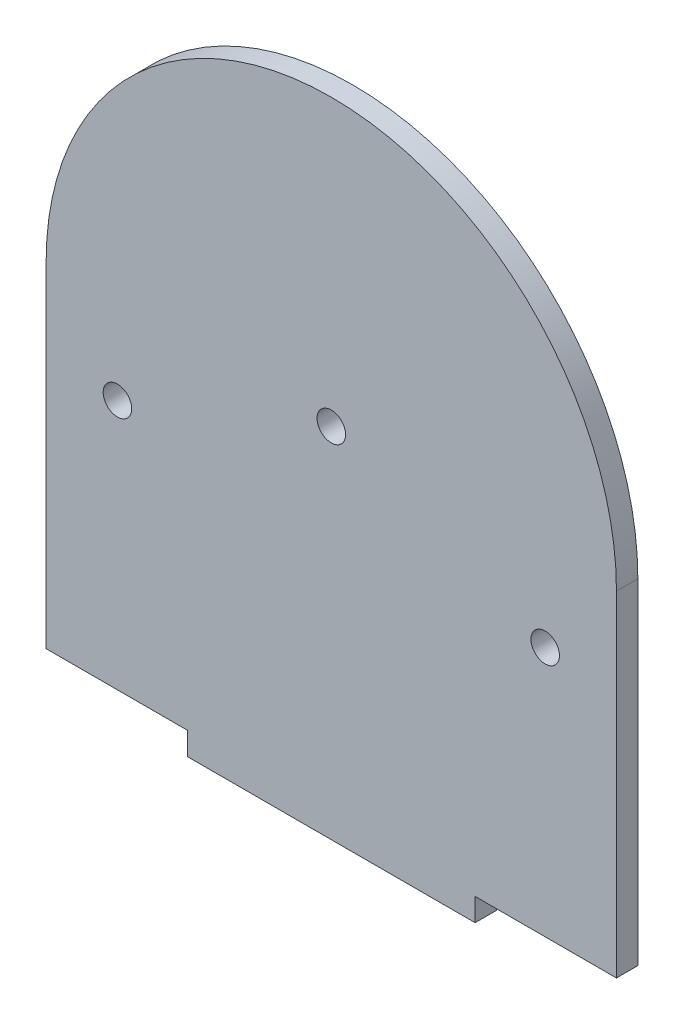
from build123d import *

# Parameters (mm, degrees)
CROQUIS1_R              = 2
SALIENTE_EXTRUIR1_DEPTH = 3


with BuildPart() as part:
    # Croquis1 → Saliente-Extruir1 (new body)
    with BuildSketch(Plane.XY):
        with BuildLine():
            Line((40, 0), (40, -47))
            Line((40, -47), (20.175, -47))
            Line((20.175, -47), (20.175, -50.2))
            Line((20.175, -50.2), (-20.175, -50.2))
            Line((-20.175, -50.2), (-20.175, -47))
            Line((-20.175, -47), (-40, -47))
            Line((-40, -47), (-40, 0))
            ThreePointArc((-40, 0), (-28.284271247, 28.284271247), (0, 40))
            ThreePointArc((0, 40), (28.284271247, 28.284271247), (40, 0))
        make_face()
        with Locations((-30, -11.85)):
            Circle(CROQUIS1_R, mode=Mode.SUBTRACT)
        with Locations(Location((30, -11.85, 0), (0, 0, 180))):
            Circle(CROQUIS1_R, mode=Mode.SUBTRACT)
        Circle(CROQUIS1_R, mode=Mode.SUBTRACT)
    extrude(amount=SALIENTE_EXTRUIR1_DEPTH)


solid = part.part
